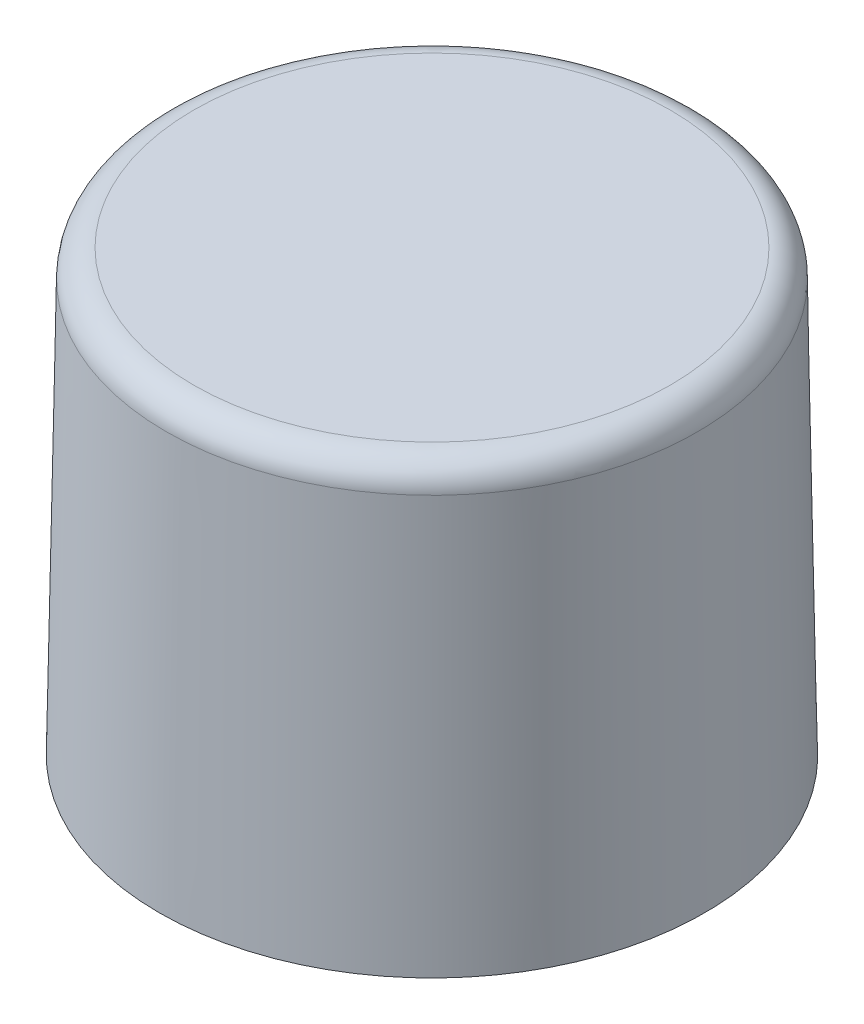
from build123d import *

# Parameters (mm, degrees)
BOSS_EXTRUDE1_DEPTH = 3.25
CIRPATTERN1_COUNT   = 6
BOSS_EXTRUDE2_DEPTH = 0.85
CIRPATTERN2_COUNT   = 3
FILLET1_R           = 0.25


with BuildPart() as part:
    # Sketch1 → Revolve1 (revolve)
    with BuildSketch(Plane.XY, mode=Mode.PRIVATE) as revolve1_sk:
        Polygon((-1.827800985, 3.45), (0, 3.45), (0, 4.03), (-2.429656088, 4.03), (-2.5, 0), (-2, 0), (-1.884529946, 0.2), align=None)
    revolve(revolve1_sk.sketch.rotate(Axis((0, 0, 0), (0, 1, 0)), 270), axis=Axis((0, 0, 0), (0, 1, 0)))

    # Sketch2 → Boss-Extrude1 (add)
    with BuildSketch(Plane.XZ.offset(-3.45)):
        with BuildLine():
            Line((-2, 0.25), (-1.5, 0.25))
            ThreePointArc((-1.5, 0.25), (-1.25, 0), (-1.5, -0.25))
            Line((-1.5, -0.25), (-2, -0.25))
            ThreePointArc((-2, -0.25), (-2.25, 0), (-2, 0.25))
        make_face()
    boss_extrude1 = extrude(amount=BOSS_EXTRUDE1_DEPTH)

    # CirPattern1: Boss-Extrude1 ×6 about axis
    cirpattern1_axis = Axis((0, 0, 0), (0, 1, 0))
    for i in range(1, CIRPATTERN1_COUNT):
        add(boss_extrude1.rotate(cirpattern1_axis, i * 360 / CIRPATTERN1_COUNT))

    # Sketch3 → Boss-Extrude2 (add)
    with BuildSketch(Plane.XZ.offset(-3.45)):
        with BuildLine():
            Line((-0.25, 0.65), (-0.25, 2))
            ThreePointArc((-0.25, 2), (0, 2.25), (0.25, 2))
            Line((0.25, 2), (0.25, 0.65))
            ThreePointArc((0.25, 0.65), (0, 0.4), (-0.25, 0.65))
        make_face()
    boss_extrude2 = extrude(amount=BOSS_EXTRUDE2_DEPTH)

    # CirPattern2: Boss-Extrude2 ×3 about axis
    cirpattern2_axis = Axis((0, 0, 0), (0, 1, 0))
    for i in range(1, CIRPATTERN2_COUNT):
        add(boss_extrude2.rotate(cirpattern2_axis, i * 360 / CIRPATTERN2_COUNT))

    # Fillet1
    fillet1_edges = [part.edges().sort_by_distance(p)[0] for p in [
        (0, 4.03, 2.429656088),
    ]]
    fillet(fillet1_edges, radius=FILLET1_R)


solid = part.part
